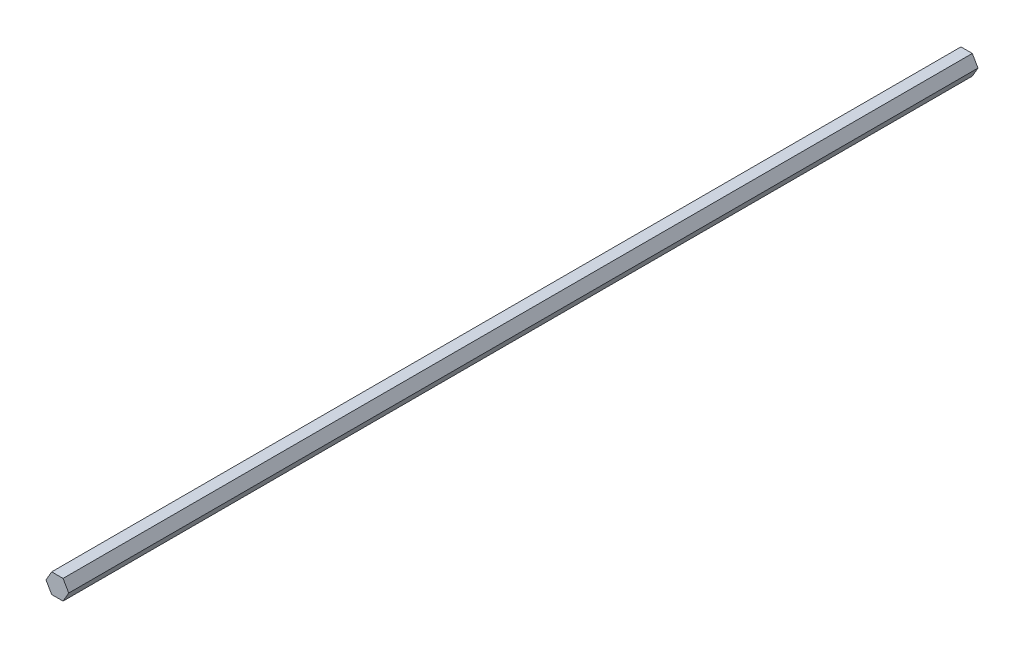
from build123d import *

# Parameters (mm, degrees)
BOSS_EXTRUDE1_DEPTH = 292.1


with BuildPart() as part:
    # Sketch 1 → Boss-Extrude1 (new, symmetric)
    with BuildSketch(Plane.XY):
        Polygon((7.3025, 0), (3.65125, 6.324150511), (-3.65125, 6.324150511), (-7.3025, 0), (-3.65125, -6.324150511), (3.65125, -6.324150511), align=None)
    extrude(amount=BOSS_EXTRUDE1_DEPTH, both=True)


solid = part.part
